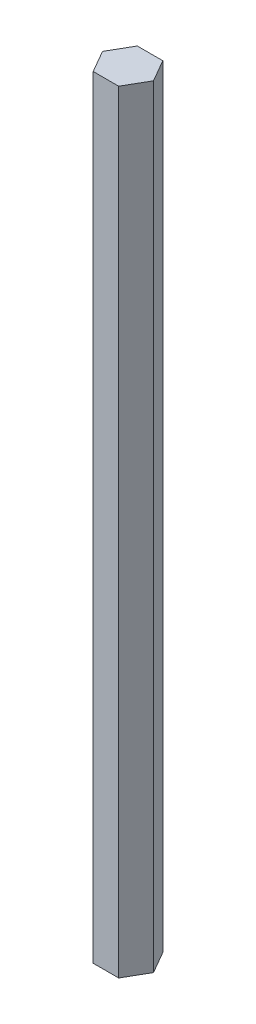
from build123d import *

# Parameters (mm, degrees)
BOSS_EXTRUDE1_DEPTH = 222.25


with BuildPart() as part:
    # Sketch1 → Boss-Extrude1 (new body)
    with BuildSketch(Plane(origin=(0, 0, 0), x_dir=(1, 0, 0), z_dir=(0, 1, 0))):
        Polygon((3.666174209, -6.35), (7.332348419, 0), (3.666174209, 6.35), (-3.666174209, 6.35), (-7.332348419, 0), (-3.666174209, -6.35), align=None)
    extrude(amount=BOSS_EXTRUDE1_DEPTH)


solid = part.part
